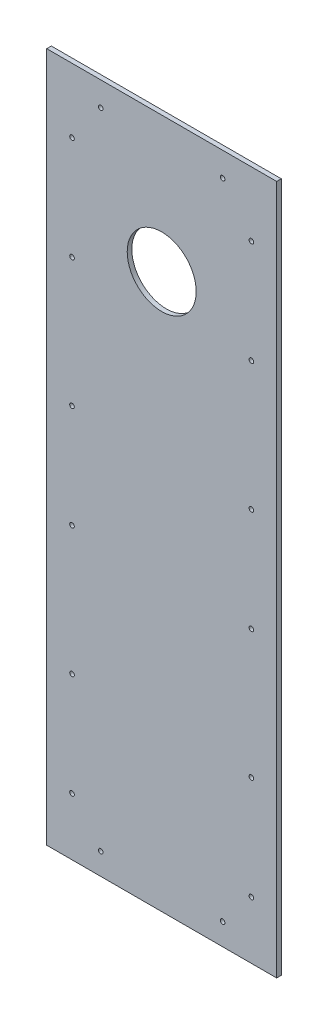
from build123d import *

# Parameters (mm, degrees)
SKETCH1_W           = 100
SKETCH1_H           = 300
BOSS_EXTRUDE1_DEPTH = 2
SKETCH2_R           = 1
CUT_EXTRUDE1_DEPTH  = 10
SKETCH3_R           = 15
CUT_EXTRUDE2_DEPTH  = 10
SKETCH4_R           = 1
CUT_EXTRUDE3_DEPTH  = 10


with BuildPart() as part:
    # Sketch1 → Boss-Extrude1 (new body)
    with BuildSketch(Plane.XY):
        Rectangle(SKETCH1_W, SKETCH1_H)
    extrude(amount=BOSS_EXTRUDE1_DEPTH)

    # Sketch2 → Cut-Extrude1 (cut)
    with BuildSketch(Plane.XY.offset(2)):
        with Locations((-39, 122)):
            Circle(SKETCH2_R)
        with Locations((-39, 77)):
            Circle(SKETCH2_R)
        with Locations((39, 122)):
            Circle(SKETCH2_R)
        with Locations((39, 77)):
            Circle(SKETCH2_R)
        with Locations((-39, 21)):
            Circle(SKETCH2_R)
        with Locations((-39, -24)):
            Circle(SKETCH2_R)
        with Locations((39, 21)):
            Circle(SKETCH2_R)
        with Locations((39, -24)):
            Circle(SKETCH2_R)
        with Locations((-39, -80)):
            Circle(SKETCH2_R)
        with Locations((-39, -125)):
            Circle(SKETCH2_R)
        with Locations((39, -80)):
            Circle(SKETCH2_R)
        with Locations((39, -125)):
            Circle(SKETCH2_R)
    extrude(amount=-CUT_EXTRUDE1_DEPTH, mode=Mode.SUBTRACT)

    # Sketch3 → Cut-Extrude2 (cut)
    with BuildSketch(Plane(origin=(0, 0, 0), x_dir=(-1, 0, 0), z_dir=(0, 0, -1))):
        with Locations((0, 91)):
            Circle(SKETCH3_R)
    extrude(amount=-CUT_EXTRUDE2_DEPTH, mode=Mode.SUBTRACT)

    # Sketch4 → Cut-Extrude3 (cut)
    with BuildSketch(Plane(origin=(0, 0, 0), x_dir=(-1, 0, 0), z_dir=(0, 0, -1))):
        with Locations((-26.5, 139.5)):
            Circle(SKETCH4_R)
        with Locations((26.5, 139.5)):
            Circle(SKETCH4_R)
        with Locations((-26.5, -140.5)):
            Circle(SKETCH4_R)
        with Locations((26.5, -140.5)):
            Circle(SKETCH4_R)
    extrude(amount=-CUT_EXTRUDE3_DEPTH, mode=Mode.SUBTRACT)


solid = part.part
